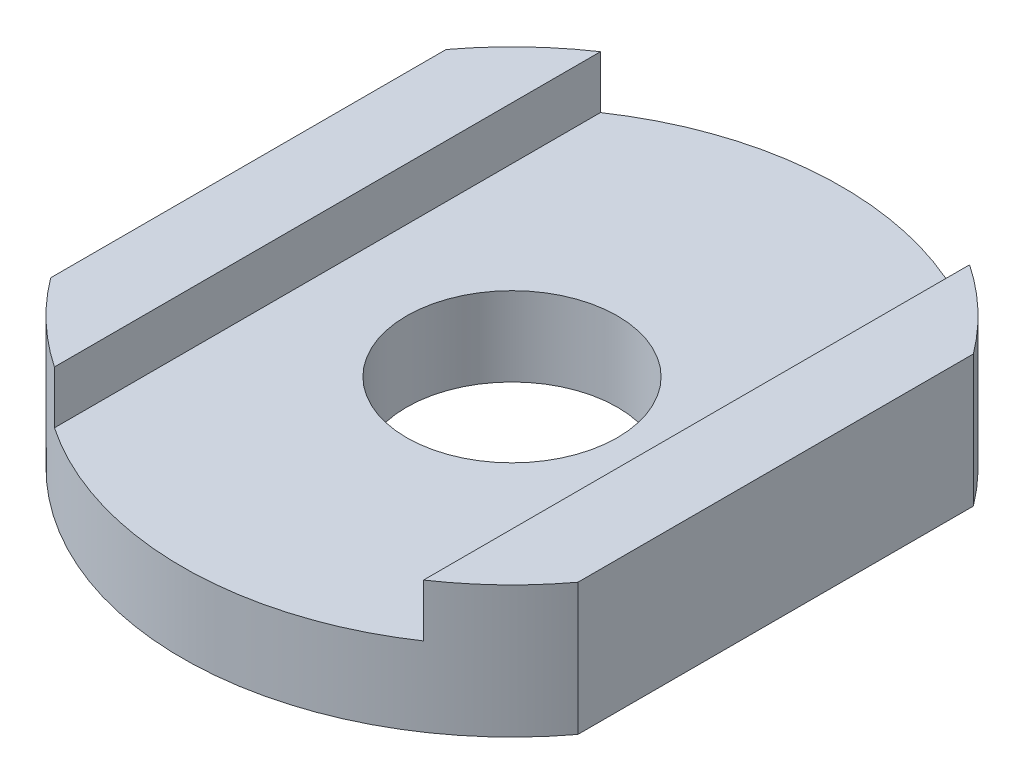
from build123d import *

# Parameters (mm, degrees)
SKETCH1_R           = 4
BOSS_EXTRUDE1_DEPTH = 3
BOSS_EXTRUDE2_DEPTH = 5


with BuildPart() as part:
    # Sketch1 → Boss-Extrude1 (new body)
    with BuildSketch(Plane(origin=(0, 0, 0), x_dir=(1, 0, 0), z_dir=(0, 1, 0))):
        with BuildLine():
            Line((10, -7.5), (10, 7.5))
            ThreePointArc((10, 7.5), (0, 12.5), (-10, 7.5))
            Line((-10, 7.5), (-10, -7.5))
            ThreePointArc((-10, -7.5), (0, -12.5), (10, -7.5))
        make_face()
        Circle(SKETCH1_R, mode=Mode.SUBTRACT)
    extrude(amount=BOSS_EXTRUDE1_DEPTH)

    # Sketch1<3> → Boss-Extrude2 (add)
    with BuildSketch(Plane(origin=(0, 0, 0), x_dir=(1, 0, 0), z_dir=(0, 1, 0))):
        with BuildLine():
            Line((10, -7.5), (10, 7.5))
            ThreePointArc((10, 7.5), (8.619130411, 9.053208876), (7, 10.356157589))
            Line((7, 10.356157589), (7, -10.356157589))
            ThreePointArc((7, -10.356157589), (8.619130411, -9.053208876), (10, -7.5))
        make_face()
        with BuildLine():
            Line((-7, -10.356157589), (-7, 10.356157589))
            ThreePointArc((-7, 10.356157589), (-8.619130411, 9.053208876), (-10, 7.5))
            Line((-10, 7.5), (-10, -7.5))
            ThreePointArc((-10, -7.5), (-8.619130411, -9.053208876), (-7, -10.356157589))
        make_face()
    extrude(amount=BOSS_EXTRUDE2_DEPTH)


solid = part.part
